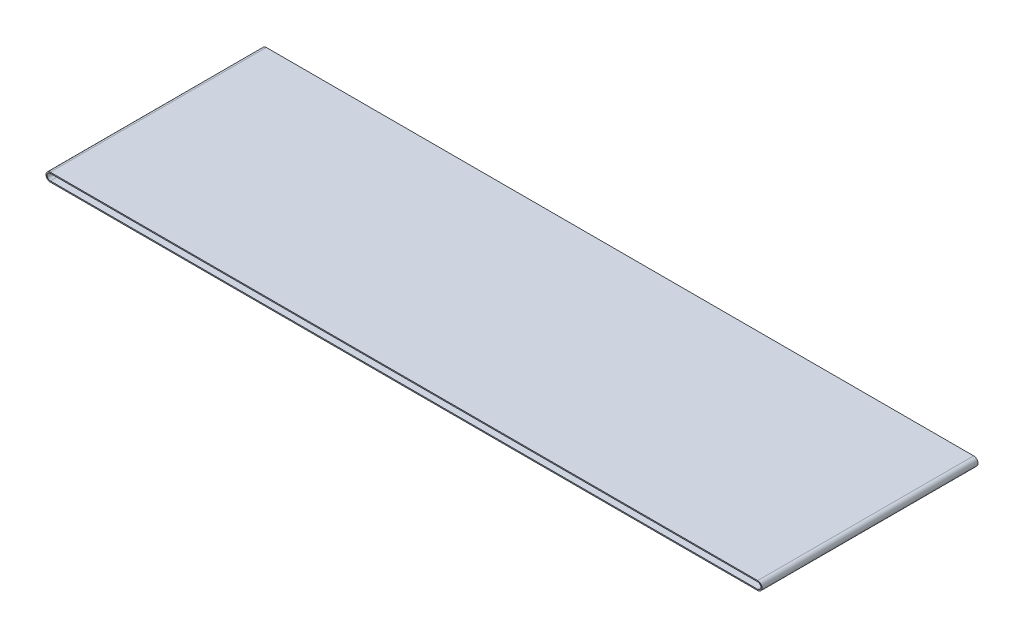
from build123d import *

# Parameters (mm, degrees)
EXTRUDE_THIN1_DEPTH = 100


with BuildPart() as part:
    # Sketch2 → Extrude-Thin1 (new, symmetric)
    with BuildSketch(Plane.XY):
        with BuildLine():
            Line((654.967604407, -4), (0, -4))
            ThreePointArc((0, -4), (-4, 0), (0, 4))
            Line((0, 4), (654.967604407, 4))
            ThreePointArc((654.967604407, 4), (658.967604407, 0), (654.967604407, -4))
        make_face()
        with BuildLine():
            Line((654.967604407, -3), (0, -3))
            ThreePointArc((0, -3), (-3, 0), (0, 3))
            Line((0, 3), (654.967604407, 3))
            ThreePointArc((654.967604407, 3), (657.967604407, 0), (654.967604407, -3))
        make_face(mode=Mode.SUBTRACT)
    extrude(amount=EXTRUDE_THIN1_DEPTH, both=True)


solid = part.part
